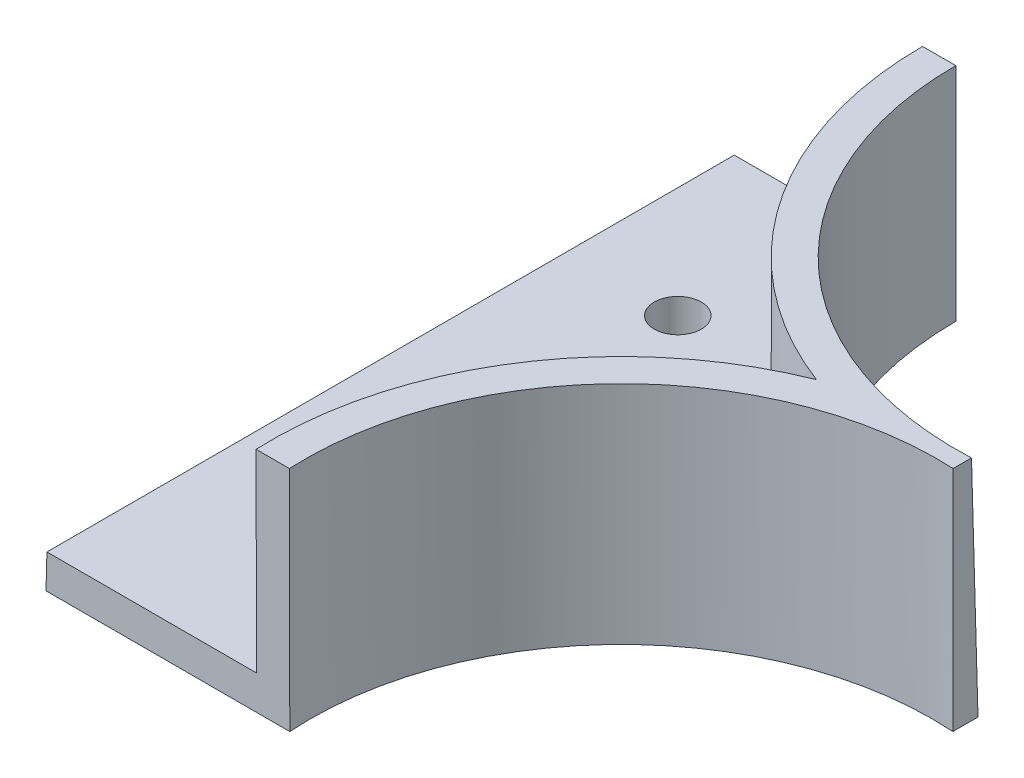
from build123d import *

# Parameters (mm, degrees)
SKETCH_1_W          = 50
SKETCH_1_H          = 30.1
EXTRUDE_1_DEPTH     = 70
CUT_EXTRUDE_2_DEPTH = 70
DRAFT_4_ANGLE       = 1.591
SKETCH_4_W          = 61.588766385
SKETCH_4_H          = 50
CUT_EXTRUDE_3_DEPTH = 93.871109174
SHELL_2_T           = -3
SKETCH_5_R          = 2.125
CUT_EXTRUDE_4_DEPTH = 64.356474986


with BuildPart() as part:
    # 草圖1 → 填料-伸長1 (new body)
    with BuildSketch(Plane(origin=(0, 0, 0), x_dir=(1, 0, 0), z_dir=(0, 1, 0))):
        with Locations((25, 15.05)):
            Rectangle(SKETCH_1_W, SKETCH_1_H)
    extrude_1 = extrude(amount=EXTRUDE_1_DEPTH)

    # 草圖3 → 除料-伸長2 (cut)
    with BuildSketch(Plane(origin=(0, 70, 0), x_dir=(1, 0, 0), z_dir=(0, 1, 0))):
        with BuildLine():
            Line((20, 30.1), (50, 30.1))
            Line((50, 30.1), (50, 0.1))
            ThreePointArc((50, 0.1), (28.786796564, 8.886796564), (20, 30.1))
        make_face()
    cut_extrude_2 = extrude(amount=-CUT_EXTRUDE_2_DEPTH, mode=Mode.SUBTRACT)

    # 鏡射1: 填料-伸長1, 除料-伸長2 across plane
    add(extrude_1.mirror(Plane.XY))
    add(cut_extrude_2.mirror(Plane.XY), mode=Mode.SUBTRACT)

    # 拔模4
    draft_4_faces = [part.faces().sort_by_distance(p)[0] for p in [
        (50, 35, 0),
        (10, 35, 30.1),
        (28.786796564, 35, 8.886796564),
    ]]
    draft(draft_4_faces, Plane.ZX.offset(70), DRAFT_4_ANGLE)

    # 草圖4 → 除料-伸長3 (cut, through all)
    with BuildSketch(Plane.ZY):
        with Locations((0.694383193, 45)):
            Rectangle(SKETCH_4_W, SKETCH_4_H)
    extrude(amount=-CUT_EXTRUDE_3_DEPTH, mode=Mode.SUBTRACT)

    # 薄殼2
    shell_2_openings = [part.faces().sort_by_distance(p)[0] for p in [
        (10.858708279, 9.954778556, 31.767775702),
        (14.773415442, 20, 0.973960422),
        (10, 10, -30.1),
        (0, 9.985034809, 0.833467662),
    ]]
    offset(amount=SHELL_2_T, openings=shell_2_openings, kind=Kind.INTERSECTION)

    # 草圖5 → 除料-伸長4 (cut, through all)
    with BuildSketch(Plane(origin=(0, 3, 0), x_dir=(1, 0, 0), z_dir=(0, 1, 0))):
        with Locations(Location((10, 15, 0), (0, 0, 270))):
            Circle(SKETCH_5_R)
        with Locations(Location((10, -15, 0), (0, 0, 90))):
            Circle(SKETCH_5_R)
    extrude(amount=-CUT_EXTRUDE_4_DEPTH, mode=Mode.SUBTRACT)


solid = part.part
